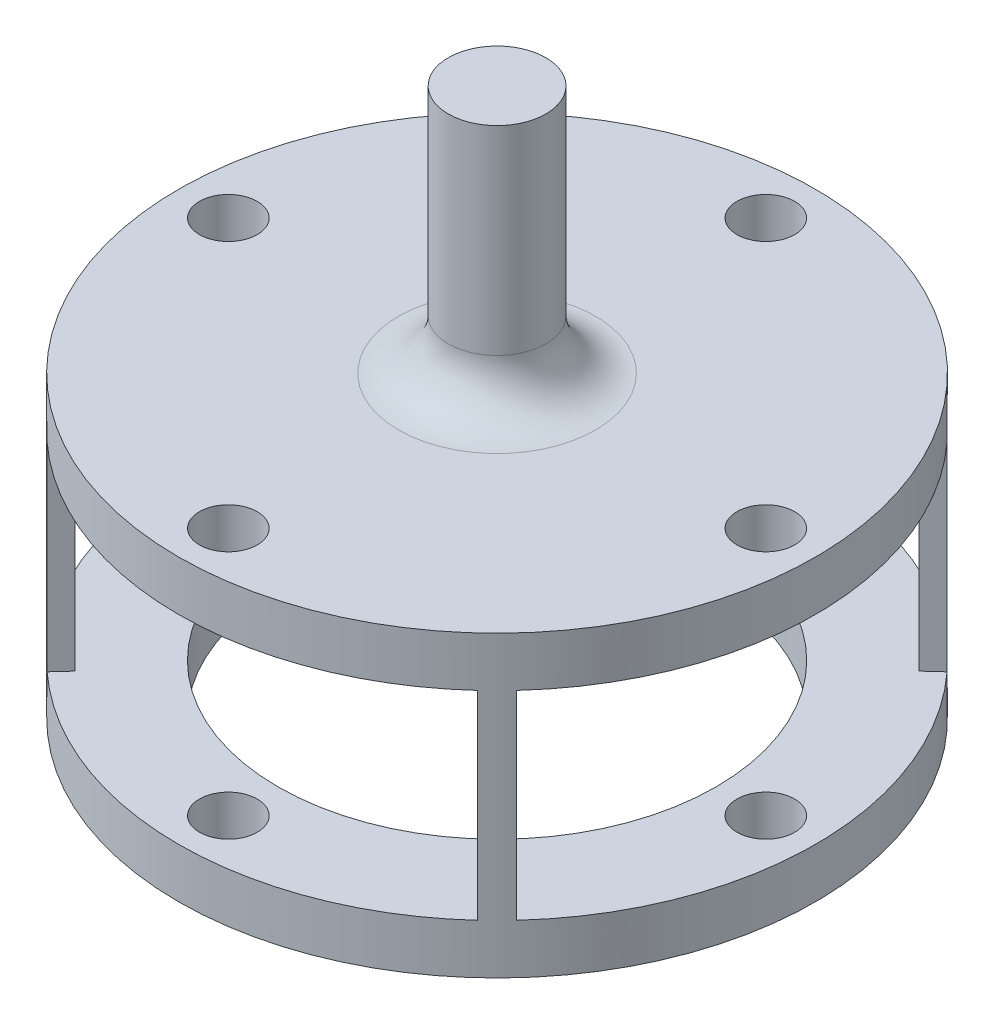
from build123d import *
from build123d.topology import SkipClean

# Parameters (mm, degrees)
SKETCH1_R               = 32
BOSS_EXTRUDE1_DEPTH     = 5
BOSS_EXTRUDE4_DEPTH     = 20
SKETCH5_R               = 32
BOSS_EXTRUDE5_DEPTH     = 5
CUT_EXTRUDE1_DEPTH      = 52.701063819
CUT_EXTRUDE1_DEPTH_BACK = 5
SKETCH2_7_R             = 2.9
SKETCH1_3_R             = 22
CUT_EXTRUDE2_DEPTH      = 10
SKETCH6_R               = 4.9
BOSS_EXTRUDE7_DEPTH     = 25
FILLET1_R               = 5


with BuildPart() as part:
    # Sketch1 → Boss-Extrude1 (new body)
    with BuildSketch(Plane(origin=(0, 0, 0), x_dir=(1, 0, 0), z_dir=(0, 1, 0))):
        Circle(SKETCH1_R)
    extrude(amount=BOSS_EXTRUDE1_DEPTH)

    # Sketch2 → Boss-Extrude4 (add)
    with SkipClean():  # the faces are left unmerged after this step: merging them gives an invalid solid
        with BuildSketch(Plane(origin=(0, 5, 0), x_dir=(1, 0, 0), z_dir=(0, 1, 0))):
            with BuildLine():
                Line((-23.592874778, 21.618886644), (-22.118320104, 20.267706228))
                ThreePointArc((-22.118320104, 20.267706228), (-21.213203436, 21.213203436), (-20.267706228, 22.118320104))
                Line((-20.267706228, 22.118320104), (-21.618886644, 23.592874778))
                ThreePointArc((-21.618886644, 23.592874778), (-22.627416998, 22.627416998), (-23.592874778, 21.618886644))
            make_face()
            with BuildLine():
                Line((23.592874778, 21.618886644), (22.118320104, 20.267706228))
                ThreePointArc((22.118320104, 20.267706228), (21.213203436, 21.213203436), (20.267706228, 22.118320104))
                Line((20.267706228, 22.118320104), (21.618886644, 23.592874778))
                ThreePointArc((21.618886644, 23.592874778), (22.627416998, 22.627416998), (23.592874778, 21.618886644))
            make_face()
            with BuildLine():
                Line((21.618886644, -23.592874778), (20.267706228, -22.118320104))
                ThreePointArc((20.267706228, -22.118320104), (21.213203436, -21.213203436), (22.118320104, -20.267706228))
                Line((22.118320104, -20.267706228), (23.592874778, -21.618886644))
                ThreePointArc((23.592874778, -21.618886644), (22.627416998, -22.627416998), (21.618886644, -23.592874778))
            make_face()
            with BuildLine():
                Line((-23.592874778, -21.618886644), (-22.118320104, -20.267706228))
                ThreePointArc((-22.118320104, -20.267706228), (-21.213203436, -21.213203436), (-20.267706228, -22.118320104))
                Line((-20.267706228, -22.118320104), (-21.618886644, -23.592874778))
                ThreePointArc((-21.618886644, -23.592874778), (-22.627416998, -22.627416998), (-23.592874778, -21.618886644))
            make_face()
        extrude(amount=BOSS_EXTRUDE4_DEPTH)

    # Sketch5 → Boss-Extrude5 (add)
    with SkipClean():  # the faces are left unmerged after this step: merging them gives an invalid solid
        with BuildSketch(Plane(origin=(0, 25, 0), x_dir=(1, 0, 0), z_dir=(0, 1, 0))):
            Circle(SKETCH5_R)
        extrude(amount=BOSS_EXTRUDE5_DEPTH)

    # Sketch2<7> → Cut-Extrude1 (cut, two sides: drawn at the far end of the back side and taken through both)
    with SkipClean():  # the faces are left unmerged after this step: merging them gives an invalid solid
        with BuildSketch(Plane(origin=(0, 5, 0), x_dir=(1, 0, 0), z_dir=(0, 1, 0)).offset(-CUT_EXTRUDE1_DEPTH_BACK)):
            with Locations((0, 27)):
                Circle(SKETCH2_7_R)
            with Locations((27, 0)):
                Circle(SKETCH2_7_R)
            with Locations((0, -27)):
                Circle(SKETCH2_7_R)
            with Locations((-27, 0)):
                Circle(SKETCH2_7_R)
        extrude(amount=CUT_EXTRUDE1_DEPTH + CUT_EXTRUDE1_DEPTH_BACK, mode=Mode.SUBTRACT)

    # Sketch1<3> → Cut-Extrude2 (cut)
    with SkipClean():  # the faces are left unmerged after this step: merging them gives an invalid solid
        with BuildSketch(Plane(origin=(0, 0, 0), x_dir=(1, 0, 0), z_dir=(0, 1, 0))):
            Circle(SKETCH1_3_R)
        extrude(amount=CUT_EXTRUDE2_DEPTH, mode=Mode.SUBTRACT)

    # Sketch6 → Boss-Extrude7 (add)
    with SkipClean():  # the faces are left unmerged after this step: merging them gives an invalid solid
        with BuildSketch(Plane(origin=(0, 30, 0), x_dir=(1, 0, 0), z_dir=(0, 1, 0))):
            Circle(SKETCH6_R)
        extrude(amount=BOSS_EXTRUDE7_DEPTH)

    # Fillet1
    fillet1_edges = [part.edges().sort_by_distance(p)[0] for p in [
        (-4.9, 30, 0),
    ]]
    fillet(fillet1_edges, radius=FILLET1_R)


solid = part.part
